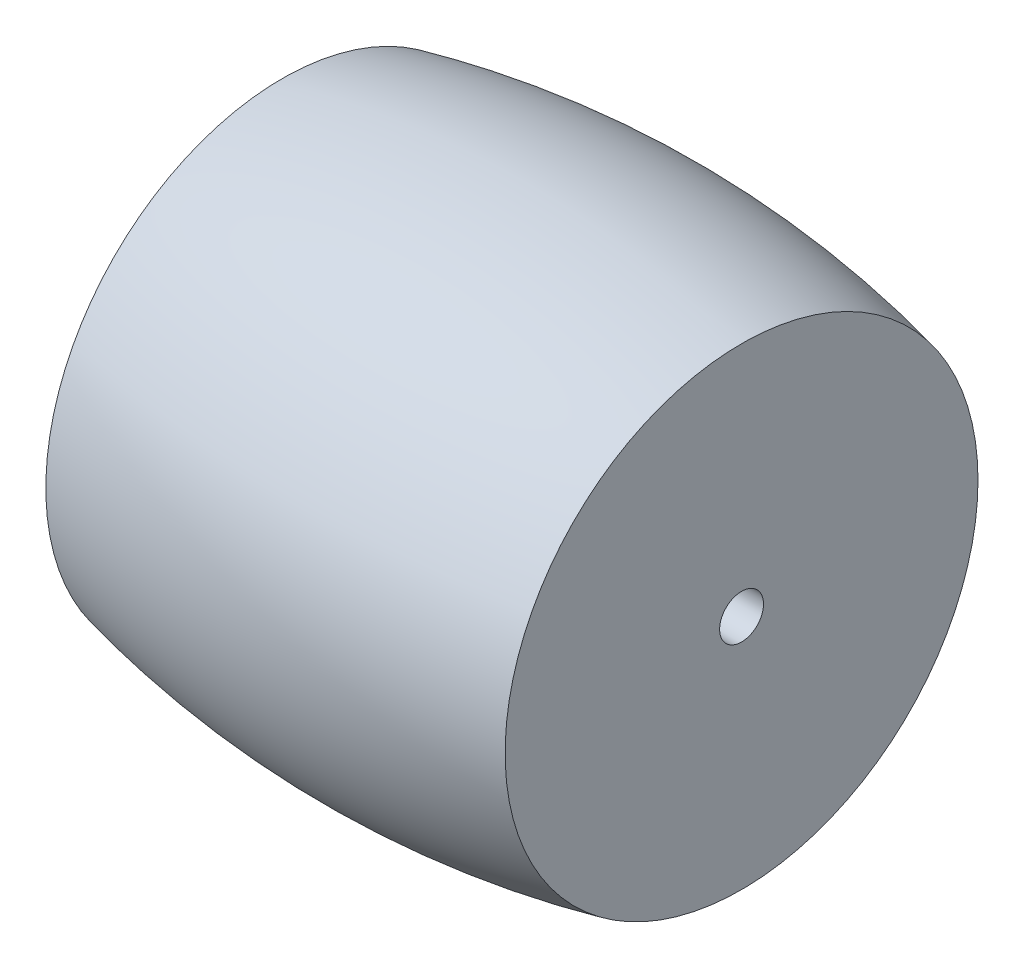
from build123d import *


with BuildPart() as part:
    # Sketch3 → Revolve1 (revolve)
    with BuildSketch(Plane.XY, mode=Mode.PRIVATE) as revolve1_sk:
        with BuildLine():
            Line((-14.647440478, 1.4), (-14.647440478, 15.08125))
            ThreePointArc((-14.647440478, 15.08125), (-13.150997434, 15.404541787), (-11.647440478, 15.69294401))
            Line((-11.647440478, 15.69294401), (-11.647440478, 3.4))
            Line((-11.647440478, 3.4), (-1.5, 3.4))
            Line((-1.5, 3.4), (-1.5, 16.71452719))
            ThreePointArc((-1.5, 16.71452719), (0, 16.731620181), (1.5, 16.71452719))
            Line((1.5, 16.71452719), (1.5, 3.4))
            Line((1.5, 3.4), (11.647440478, 3.4))
            Line((11.647440478, 3.4), (11.647440478, 15.69294401))
            ThreePointArc((11.647440478, 15.69294401), (13.150997434, 15.404541787), (14.647440478, 15.08125))
            Line((14.647440478, 15.08125), (14.647440478, 1.4))
            Line((14.647440478, 1.4), (-14.647440478, 1.4))
        make_face()
    revolve(revolve1_sk.sketch.rotate(Axis((23.642125672, 0, 0), (-1, 0, 0)), 90), axis=Axis((23.642125672, 0, 0), (-1, 0, 0)))

    # Sketch4 → Revolve2 (revolve)
    with BuildSketch(Plane.XY, mode=Mode.PRIVATE) as revolve2_sk:
        with BuildLine():
            Line((-14.647440478, 12.08125), (-14.647440478, 15.08125))
            ThreePointArc((-14.647440478, 15.08125), (0, 16.731620181), (14.647440478, 15.08125))
            Line((14.647440478, 15.08125), (14.647440478, 12.08125))
            ThreePointArc((14.647440478, 12.08125), (0, 13.731620181), (-14.647440478, 12.08125))
        make_face()
    revolve(revolve2_sk.sketch.rotate(Axis((23.642125672, 0, 0), (-1, 0, 0)), 270), axis=Axis((23.642125672, 0, 0), (-1, 0, 0)))


solid = part.part
